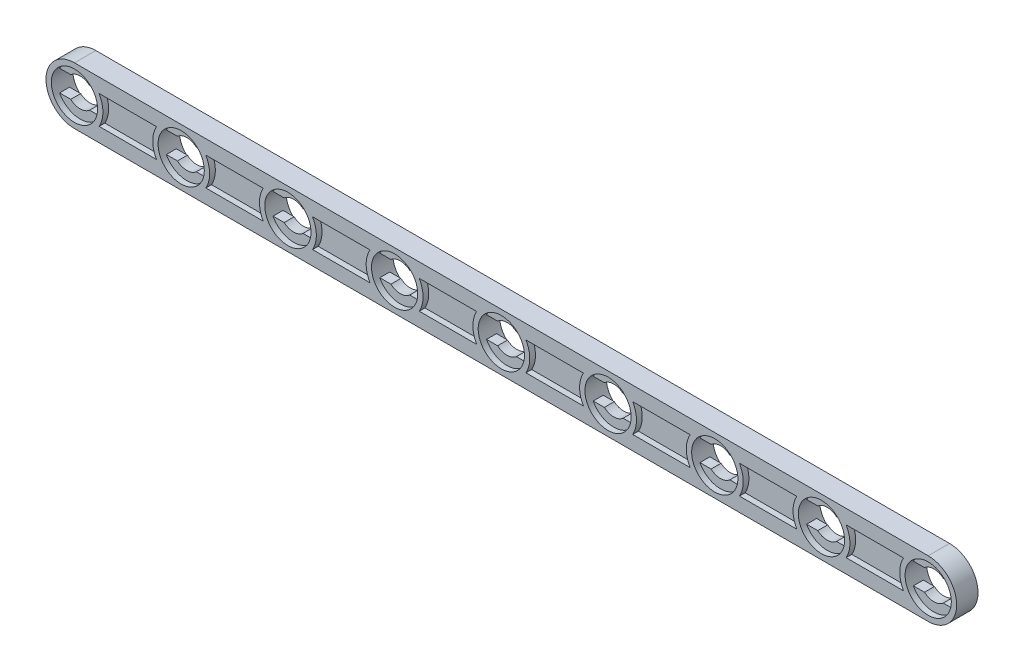
from build123d import *

# Parameters (mm, degrees)
EXTRUDE_1_DEPTH        = 3
CUT_EXTRUDE_1_REACH    = 126.101
SKETCH_3_R             = 3.25
CUT_EXTRUDE_2_DEPTH    = 0.8
CUT_EXTRUDE_START      = -2.2
SKETCH_3_2_R           = 3.25
CUT_EXTRUDE_3_DEPTH    = 0.8
CUT_EXTRUDE_4_DEPTH    = 0.8
SKETCH_5_W             = 7
SKETCH_5_H             = 4
CUT_EXTRUDE_6_DEPTH    = 0.8
PATTERN_LINEAR_1_COUNT = 9
PATTERN_LINEAR_1_PITCH = 15
PATTERN_LINEAR_2_COUNT = 8
PATTERN_LINEAR_2_PITCH = 15


with BuildPart() as part:
    # 草图1 → 凸台-拉伸1 (new body)
    with BuildSketch(Plane.XY):
        with BuildLine():
            Line((0, 4), (120, 4))
            ThreePointArc((120, 4), (124, 0), (120, -4))
            Line((120, -4), (0, -4))
            ThreePointArc((0, -4), (-4, 0), (0, 4))
        make_face()
    extrude(amount=-EXTRUDE_1_DEPTH)

    # 草图2 → 切除-拉伸1 (cut, up to next)
    with BuildSketch(Plane.XY, mode=Mode.PRIVATE) as cut_extrude_1_sk1:
        with BuildLine():
            Line((1.322875656, -1.5), (2.883140649, -1.5))
            ThreePointArc((2.883140649, -1.5), (3.25, 0), (2.883140649, 1.5))
            Line((2.883140649, 1.5), (1.322875656, 1.5))
            ThreePointArc((1.322875656, 1.5), (0, 2), (-1.322875656, 1.5))
            Line((-1.322875656, 1.5), (-2.883140649, 1.5))
            ThreePointArc((-2.883140649, 1.5), (-3.25, 0), (-2.883140649, -1.5))
            Line((-2.883140649, -1.5), (-1.322875656, -1.5))
            ThreePointArc((-1.322875656, -1.5), (0, -2), (1.322875656, -1.5))
        make_face()
    cut_extrude_1_tool1 = extrude(cut_extrude_1_sk1.sketch, amount=-CUT_EXTRUDE_1_REACH, mode=Mode.PRIVATE) & part.part
    cut_extrude_1 = cut_extrude_1_tool1.solids().sort_by_distance((0, 0, 0))[0]
    add(cut_extrude_1, mode=Mode.SUBTRACT)

    # 草图3 → 切除-拉伸2 (cut)
    with BuildSketch(Plane.XY):
        Circle(SKETCH_3_R)
    cut_extrude_2 = extrude(amount=-CUT_EXTRUDE_2_DEPTH, mode=Mode.SUBTRACT)

    # 草图3<2> → 切除-拉伸3 (cut)
    with BuildSketch(Plane.XY.offset(CUT_EXTRUDE_START)):
        Circle(SKETCH_3_2_R)
    cut_extrude_3 = extrude(amount=-CUT_EXTRUDE_3_DEPTH, mode=Mode.SUBTRACT)

    # 草图4 → 切除-拉伸4 (cut)
    with BuildSketch(Plane.XY):
        with BuildLine():
            Line((3.464101615, 2), (11.535898385, 2))
            ThreePointArc((11.535898385, 2), (11, 0), (11.535898385, -2))
            Line((11.535898385, -2), (3.464101615, -2))
            ThreePointArc((3.464101615, -2), (4, 0), (3.464101615, 2))
        make_face()
    cut_extrude_4 = extrude(amount=-CUT_EXTRUDE_4_DEPTH, mode=Mode.SUBTRACT)

    # 草图5 → 切除-拉伸6 (cut)
    with BuildSketch(Plane(origin=(0, 0, -3), x_dir=(-1, 0, 0), z_dir=(0, 0, -1))):
        with Locations((-7.5, 0)):
            Rectangle(SKETCH_5_W, SKETCH_5_H)
    cut_extrude_6 = extrude(amount=-CUT_EXTRUDE_6_DEPTH, mode=Mode.SUBTRACT)

    # 阵列(线性)1: 切除-拉伸1, 切除-拉伸2, 切除-拉伸3 ×9
    with Locations(*[(i * PATTERN_LINEAR_1_PITCH, 0, 0) for i in range(1, PATTERN_LINEAR_1_COUNT)]):
        add(cut_extrude_1, mode=Mode.SUBTRACT)
        add(cut_extrude_2, mode=Mode.SUBTRACT)
        add(cut_extrude_3, mode=Mode.SUBTRACT)

    # 阵列(线性)2: 切除-拉伸4, 切除-拉伸6 ×8
    with Locations(*[(i * PATTERN_LINEAR_2_PITCH, 0, 0) for i in range(1, PATTERN_LINEAR_2_COUNT)]):
        add(cut_extrude_4, mode=Mode.SUBTRACT)
        add(cut_extrude_6, mode=Mode.SUBTRACT)


solid = part.part
